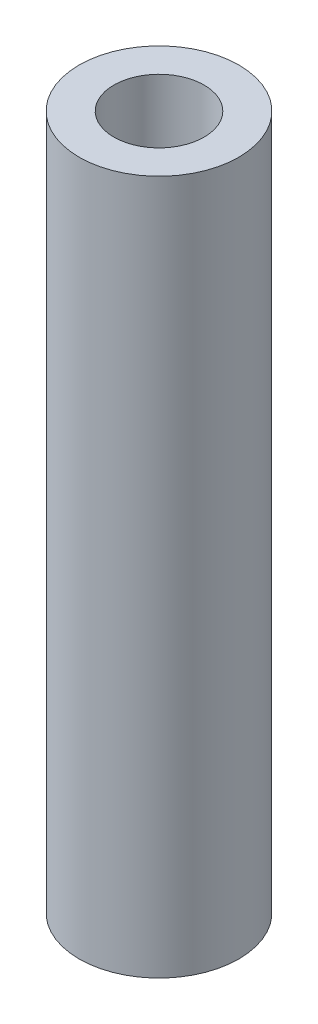
from build123d import *

# Parameters (mm, degrees)
SKETCH1_R           = 2.921
SKETCH1_R_2         = 1.651
BOSS_EXTRUDE1_DEPTH = 25.4


with BuildPart() as part:
    # Sketch1 → Boss-Extrude1 (new body)
    with BuildSketch(Plane(origin=(0, 0, 0), x_dir=(1, 0, 0), z_dir=(0, 1, 0))):
        with Locations(Location((0, 0, 0), (0, 0, 270))):
            Circle(SKETCH1_R)
        with Locations(Location((0, 0, 0), (0, 0, 270))):
            Circle(SKETCH1_R_2, mode=Mode.SUBTRACT)
    extrude(amount=BOSS_EXTRUDE1_DEPTH)


solid = part.part
